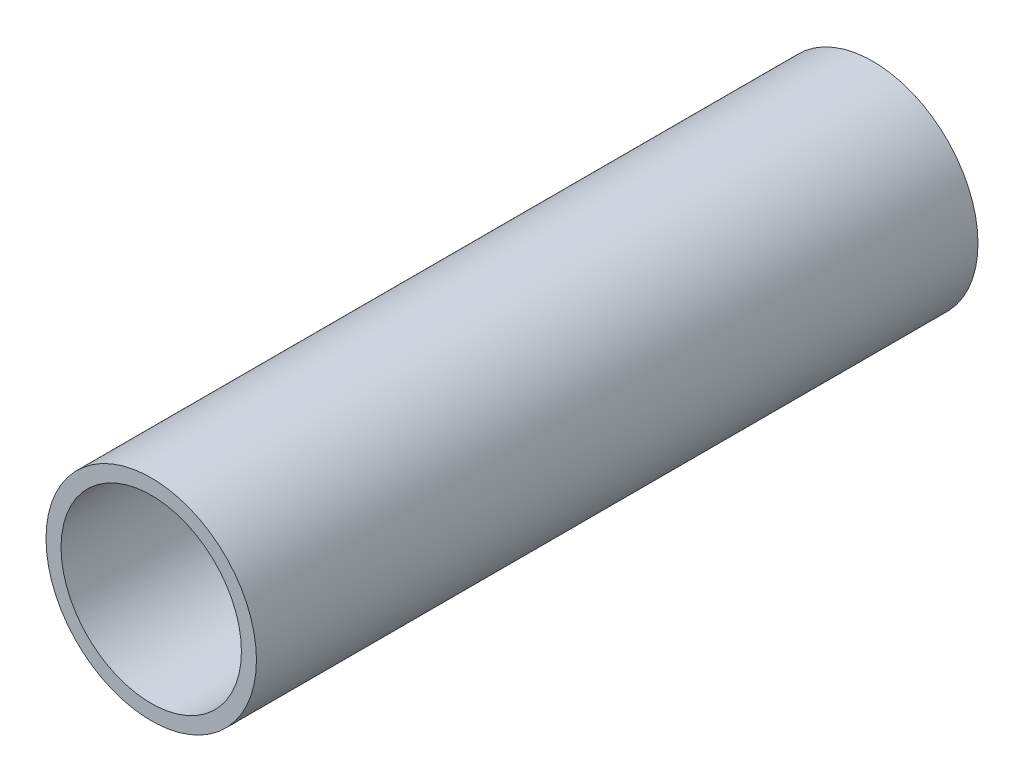
from build123d import *

# Parameters (mm, degrees)
SKETCH1_R           = 44.45
SKETCH1_R_2         = 38.1
BOSS_EXTRUDE1_DEPTH = 304.8


with BuildPart() as part:
    # Sketch1 → Boss-Extrude1 (new body)
    with BuildSketch(Plane.XY):
        with Locations(Location((0, 0, 0), (0, 0, 180))):
            Circle(SKETCH1_R)
        with Locations(Location((0, 0, 0), (0, 0, 180))):
            Circle(SKETCH1_R_2, mode=Mode.SUBTRACT)
    extrude(amount=BOSS_EXTRUDE1_DEPTH)


solid = part.part
